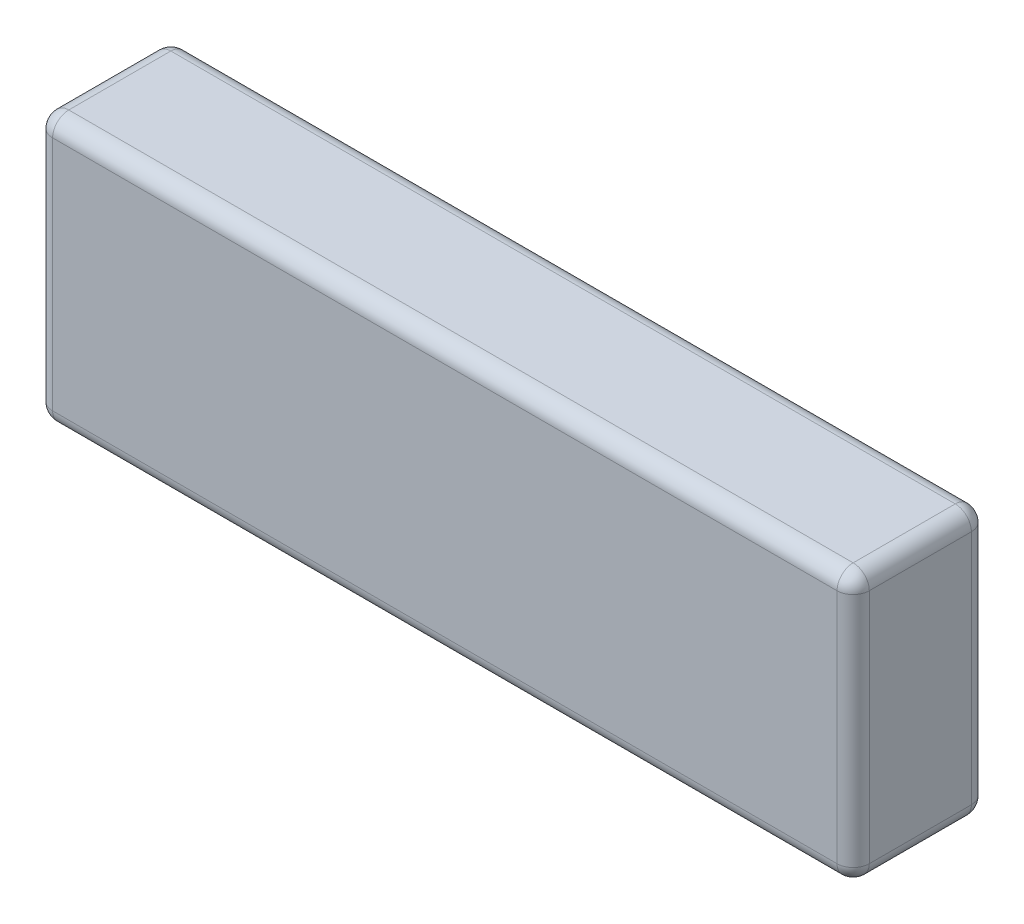
from build123d import *

# Parameters (mm, degrees)
SKETCH1_W           = 152
SKETCH1_H           = 25
BOSS_EXTRUDE1_DEPTH = 50
FILLET1_R           = 3


with BuildPart() as part:
    # Sketch1 → Boss-Extrude1 (new body)
    with BuildSketch(Plane(origin=(0, 0, 0), x_dir=(1, 0, 0), z_dir=(0, 1, 0))):
        Rectangle(SKETCH1_W, SKETCH1_H)
    extrude(amount=BOSS_EXTRUDE1_DEPTH)

    # Fillet1
    fillet1_edges = [part.edges().sort_by_distance(p)[0] for p in [
        (-76, 50, 0),
        (0, 50, 12.5),
        (76, 50, 0),
        (0, 0, 12.5),
        (-76, 0, 0),
        (0, 0, -12.5),
        (76, 0, 0),
        (0, 50, -12.5),
        (76, 25, 12.5),
        (-76, 25, 12.5),
        (-76, 25, -12.5),
        (76, 25, -12.5),
    ]]
    fillet(fillet1_edges, radius=FILLET1_R)


solid = part.part
